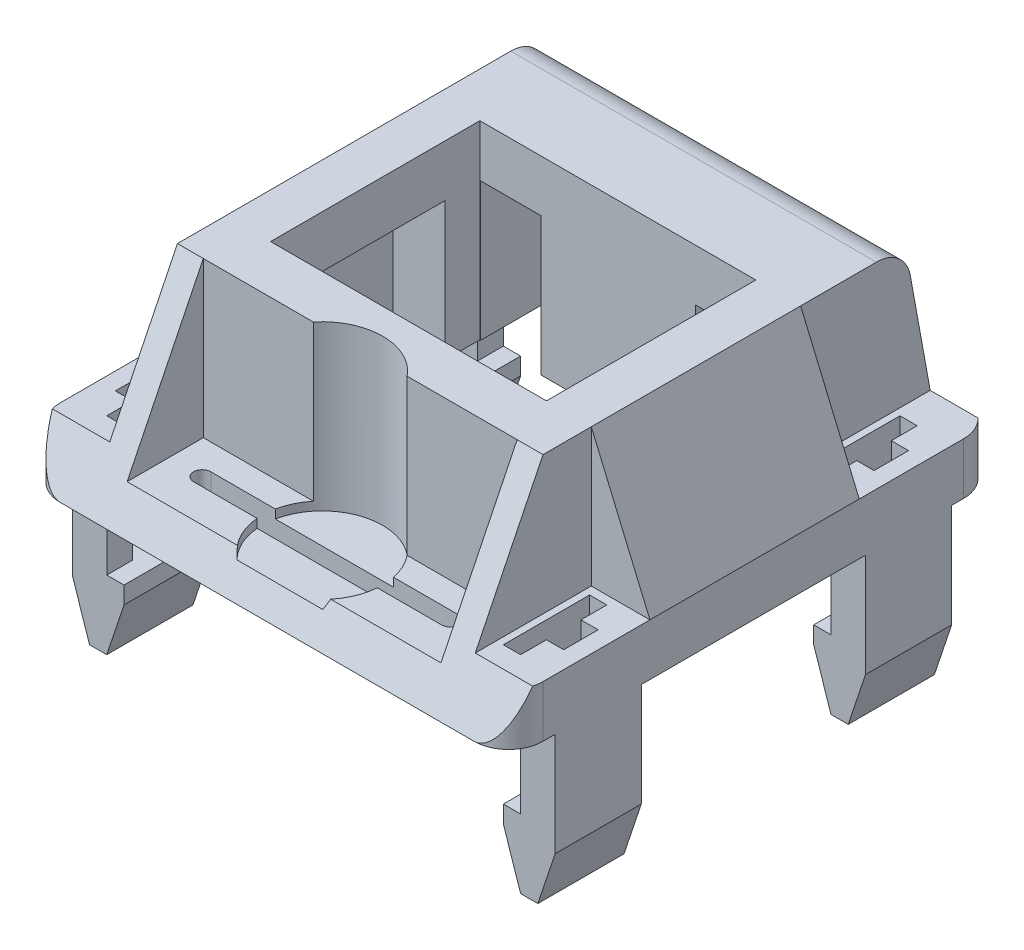
from build123d import *

# Parameters (mm, degrees)
BOSS_EXTRUDE1_DEPTH = 1.5
SKETCH2_W           = 10.6
SKETCH2_H           = 11.5
BOSS_EXTRUDE2_DEPTH = 4
BOSS_EXTRUDE4_DEPTH = 6.07
SKETCH5_W           = 1.5
SKETCH5_H           = 2.5
BOSS_EXTRUDE5_DEPTH = 4.5
SKETCH6_W           = 0.5
SKETCH6_H           = 2.5
CUT_EXTRUDE1_DEPTH  = 16.632418239
CUT_EXTRUDE3_DEPTH  = 4
SKETCH8_W           = 8
SKETCH8_H           = 6.07
CUT_EXTRUDE4_DEPTH  = 15.121260567
SKETCH10_R          = 1.75
CUT_EXTRUDE5_DEPTH  = 4.75
SKETCH12_W          = 2.7
SKETCH12_H          = 4
BOSS_EXTRUDE6_DEPTH = 0.75
SKETCH13_W          = 2.7
SKETCH13_H          = 4
BOSS_EXTRUDE7_DEPTH = 0.75
CUT_EXTRUDE6_DEPTH  = 17.633099531
CUT_EXTRUDE7_DEPTH  = 12.636580254
SKETCH17_W          = 9.1
SKETCH17_H          = 2.975518652
CUT_EXTRUDE8_DEPTH  = 0.5
FILLET2_R           = 1
SKETCH18_W          = 8.152515879
SKETCH18_H          = 2.332912786
CUT_EXTRUDE9_DEPTH  = 4
SKETCH19_W          = 1.745
SKETCH19_H          = 0.376419973
SKETCH19_W_2        = 1.75
CUT_EXTRUDE10_DEPTH = 4
SKETCH20_W          = 1.5
SKETCH20_H          = 4
CUT_EXTRUDE11_DEPTH = 4


with BuildPart() as part:
    # Sketch1 → Boss-Extrude1 (new body)
    with BuildSketch(Plane(origin=(0, 0, 0), x_dir=(1, 0, 0), z_dir=(0, 1, 0))):
        with BuildLine():
            Line((-6, -7.1), (6, -7.1))
            ThreePointArc((6, -7.1), (6.707106781, -6.807106781), (7, -6.1))
            Line((7, -6.1), (7, 6.1))
            ThreePointArc((7, 6.1), (6.707106781, 6.807106781), (6, 7.1))
            Line((6, 7.1), (-6, 7.1))
            ThreePointArc((-6, 7.1), (-6.707106781, 6.807106781), (-7, 6.1))
            Line((-7, 6.1), (-7, -6.1))
            ThreePointArc((-7, -6.1), (-6.707106781, -6.807106781), (-6, -7.1))
        make_face()
    extrude(amount=BOSS_EXTRUDE1_DEPTH)

    # Sketch2 → Boss-Extrude2 (add)
    with BuildSketch(Plane(origin=(0, 1.5, 0), x_dir=(1, 0, 0), z_dir=(0, 1, 0))):
        with Locations((0, 1.35)):
            Rectangle(SKETCH2_W, SKETCH2_H)
    extrude(amount=BOSS_EXTRUDE2_DEPTH)

    # Sketch4 → Boss-Extrude4 (add)
    with BuildSketch(Plane.XY.offset(3)):
        Polygon((-5.3, 5.5), (-7, 1.5), (-5.3, 1.5), align=None)
        Polygon((5.3, 5.5), (7, 1.5), (5.3, 1.5), align=None)
    extrude(amount=-BOSS_EXTRUDE4_DEPTH)

    # Sketch5 → Boss-Extrude5 (add)
    with BuildSketch(Plane.XZ):
        with Locations((-6.25, -4.5)):
            Rectangle(SKETCH5_W, SKETCH5_H)
        with Locations((-6.25, 4.5)):
            Rectangle(SKETCH5_W, SKETCH5_H)
        with Locations((6.25, 4.5)):
            Rectangle(SKETCH5_W, SKETCH5_H)
        with Locations((6.25, -4.5)):
            Rectangle(SKETCH5_W, SKETCH5_H)
    extrude(amount=BOSS_EXTRUDE5_DEPTH)

    # Sketch6 → Cut-Extrude1 (cut, through all)
    with BuildSketch(Plane.XY.offset(5.75)):
        with Locations((-5.75, -1.25)):
            Rectangle(SKETCH6_W, SKETCH6_H)
        Polygon((-5.5, -4.5), (-5.5, -3), (-6, -4.5), align=None)
        Polygon((-7, -3), (-7, -4.5), (-6.5, -4.5), align=None)
        Polygon((6.5, -4.5), (7, -4.5), (7, -3), align=None)
        Polygon((5.5, -3), (5.5, -4.5), (6, -4.5), align=None)
        with Locations((5.75, -1.25)):
            Rectangle(SKETCH6_W, SKETCH6_H)
    extrude(amount=-CUT_EXTRUDE1_DEPTH, mode=Mode.SUBTRACT)

    # Sketch7 → Cut-Extrude3 (cut)
    with BuildSketch(Plane(origin=(0, 1.5, 0), x_dir=(1, 0, 0), z_dir=(0, 1, 0))):
        Polygon((-5.5, -3.25), (-6, -3.25), (-6, -4), (-6.5, -4), (-6.5, -5), (-6, -5), (-6, -5.75), (-5.5, -5.75), align=None)
        Polygon((-6, 4), (-6, 3.25), (-5.5, 3.25), (-5.5, 5.75), (-6, 5.75), (-6, 5), (-6.5, 5), (-6.5, 4), align=None)
        Polygon((5.5, 3.25), (6, 3.25), (6, 4), (6.5, 4), (6.5, 5), (6, 5), (6, 5.75), (5.5, 5.75), align=None)
        Polygon((6, -4), (6, -3.25), (5.5, -3.25), (5.5, -5.75), (6, -5.75), (6, -5), (6.5, -5), (6.5, -4), align=None)
    extrude(amount=-CUT_EXTRUDE3_DEPTH, mode=Mode.SUBTRACT)

    # Sketch8 → Cut-Extrude4 (cut, through all)
    with BuildSketch(Plane(origin=(0, 5.5, 0), x_dir=(1, 0, 0), z_dir=(0, 1, 0))):
        with Locations((0, 0.035)):
            Rectangle(SKETCH8_W, SKETCH8_H)
    extrude(amount=-CUT_EXTRUDE4_DEPTH, mode=Mode.SUBTRACT)

    # Sketch10 → Cut-Extrude5 (cut)
    with BuildSketch(Plane(origin=(0, 5.5, 0), x_dir=(1, 0, 0), z_dir=(0, 1, 0))):
        with Locations((0, -5.5)):
            Circle(SKETCH10_R)
    extrude(amount=-CUT_EXTRUDE5_DEPTH, mode=Mode.SUBTRACT)

    # Sketch12 → Boss-Extrude6 (add)
    with BuildSketch(Plane.ZY.offset(5.3)):
        with Locations((5.75, 3.5)):
            Rectangle(SKETCH12_W, SKETCH12_H)
    extrude(amount=-BOSS_EXTRUDE6_DEPTH)

    # Sketch13 → Boss-Extrude7 (add)
    with BuildSketch(Plane(origin=(5.3, 0, 0), x_dir=(0, 0, -1), z_dir=(1, 0, 0))):
        with Locations((-5.75, 3.5)):
            Rectangle(SKETCH13_W, SKETCH13_H)
    extrude(amount=-BOSS_EXTRUDE7_DEPTH)

    # Sketch15 → Cut-Extrude6 (cut, through all)
    with BuildSketch(Plane(origin=(7, 0, 0), x_dir=(0, 0, -1), z_dir=(1, 0, 0))):
        Polygon((-4.4, 5.5), (-7.1, 0), (-7.1, 5.5), align=None)
        Polygon((7.1, 0), (6.1, 5.5), (7.1, 5.5), align=None)
    extrude(amount=-CUT_EXTRUDE6_DEPTH, mode=Mode.SUBTRACT)

    # Sketch16 → Cut-Extrude7 (cut, through all)
    with BuildSketch(Plane(origin=(0, 1.5, 0), x_dir=(1, 0, 0), z_dir=(0, 1, 0))):
        with BuildLine():
            Line((-3.586359169, -5.147740482), (3.606419083, -5.147740482))
            ThreePointArc((3.606419083, -5.147740482), (3.856419083, -5.397740482), (3.606419083, -5.647740482))
            Line((3.606419083, -5.647740482), (-3.586359169, -5.647740482))
            ThreePointArc((-3.586359169, -5.647740482), (-3.836359169, -5.397740482), (-3.586359169, -5.147740482))
        make_face()
    extrude(amount=-CUT_EXTRUDE7_DEPTH, mode=Mode.SUBTRACT)

    # Sketch17 → Cut-Extrude8 (cut)
    with BuildSketch(Plane(origin=(0, 1.5, 0), x_dir=(1, 0, 0), z_dir=(0, 1, 0))):
        with Locations((0, -5.887759326)):
            Rectangle(SKETCH17_W, SKETCH17_H)
    extrude(amount=-CUT_EXTRUDE8_DEPTH, mode=Mode.SUBTRACT)

    # Fillet2
    fillet2_edges = [part.edges().sort_by_distance(p)[0] for p in [
        (0, 5.5, -6.1),
    ]]
    fillet(fillet2_edges, radius=FILLET2_R)

    # Sketch18 → Cut-Extrude9 (cut)
    with BuildSketch(Plane.XZ):
        with Locations((0.100583502, -4.612876366)):
            Rectangle(SKETCH18_W, SKETCH18_H)
    extrude(amount=-CUT_EXTRUDE9_DEPTH, mode=Mode.SUBTRACT)

    # Sketch19 → Cut-Extrude10 (cut)
    with BuildSketch(Plane.XZ):
        with Locations((3.1275, -3.258209987)):
            Rectangle(SKETCH19_W, SKETCH19_H)
        with Locations((-3.100674438, -3.258209987)):
            Rectangle(SKETCH19_W_2, SKETCH19_H)
    extrude(amount=-CUT_EXTRUDE10_DEPTH, mode=Mode.SUBTRACT)

    # Sketch20 → Cut-Extrude11 (cut)
    with BuildSketch(Plane.XZ):
        with Locations((4.75, -0.051196063)):
            Rectangle(SKETCH20_W, SKETCH20_H)
        with Locations((-4.75, -0.051196063)):
            Rectangle(SKETCH20_W, SKETCH20_H)
    extrude(amount=-CUT_EXTRUDE11_DEPTH, mode=Mode.SUBTRACT)


solid = part.part
